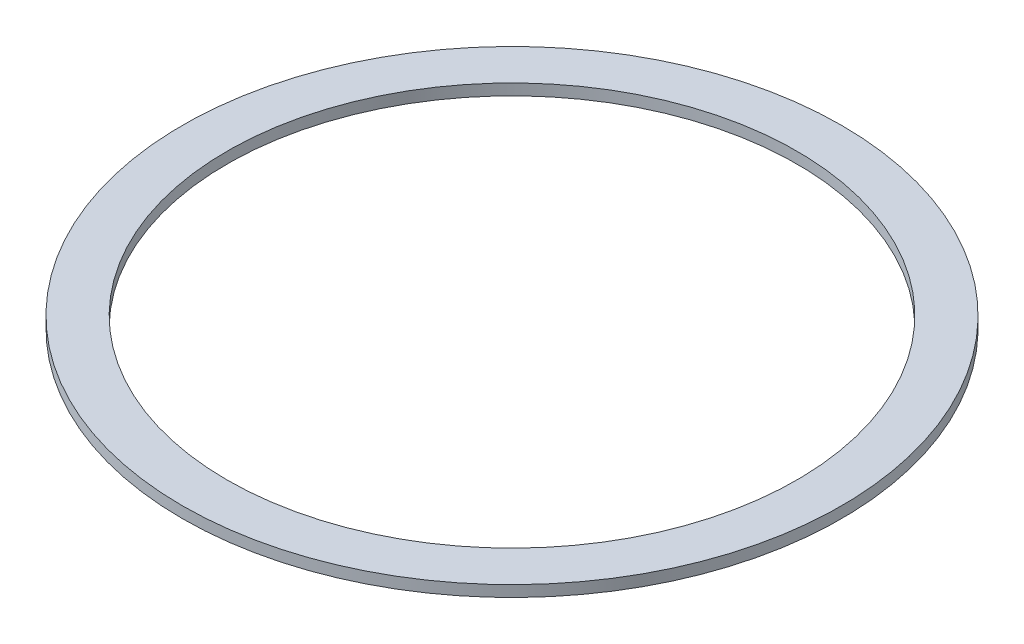
from build123d import *

# Parameters (mm, degrees)
SKETCH1_R           = 295
SKETCH1_R_2         = 255
BOSS_EXTRUDE1_DEPTH = 5


with BuildPart() as part:
    # Sketch1 → Boss-Extrude1 (new, symmetric)
    with BuildSketch(Plane(origin=(0, 0, 0), x_dir=(1, 0, 0), z_dir=(0, 1, 0))):
        with Locations(Location((0, 0, 0), (0, 0, 270))):
            Circle(SKETCH1_R)
        with Locations(Location((0, 0, 0), (0, 0, 270))):
            Circle(SKETCH1_R_2, mode=Mode.SUBTRACT)
    extrude(amount=BOSS_EXTRUDE1_DEPTH, both=True)


solid = part.part
